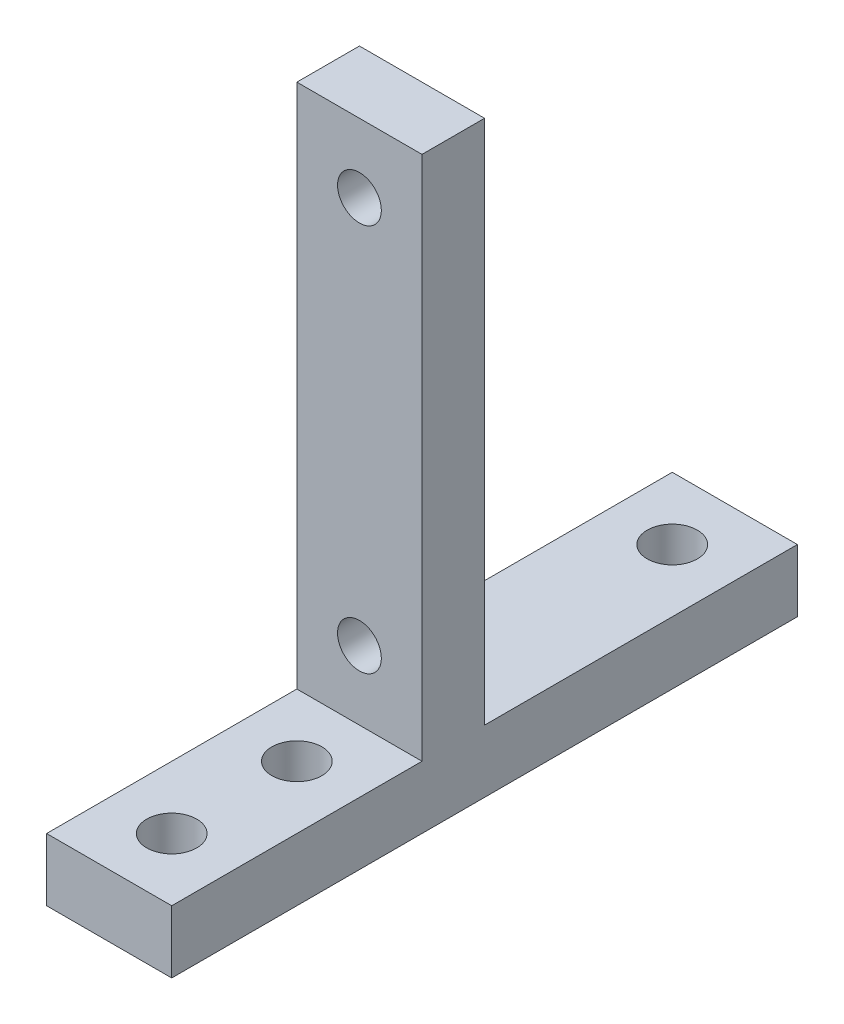
from build123d import *

# Parameters (mm, degrees)
ESBO_O1_W                = 10
ESBO_O1_H                = 42
ESBO_O1_R                = 1.75
RESSALTO_EXTRUS_O1_DEPTH = 5
ESBO_O2_W                = 10
ESBO_O2_H                = 50
ESBO_O2_R                = 2
RESSALTO_EXTRUS_O2_DEPTH = 5


with BuildPart() as part:
    # Esboço1 → Ressalto-extrusão1 (new body)
    with BuildSketch(Plane.XY):
        Rectangle(ESBO_O1_W, ESBO_O1_H)
        with Locations((0, 15.5)):
            Circle(ESBO_O1_R, mode=Mode.SUBTRACT)
        with Locations((0, -15.5)):
            Circle(ESBO_O1_R, mode=Mode.SUBTRACT)
    extrude(amount=RESSALTO_EXTRUS_O1_DEPTH)

    # Esboço2 → Ressalto-extrusão2 (add)
    with BuildSketch(Plane.XZ.offset(21)):
        Rectangle(ESBO_O2_W, ESBO_O2_H)
        with Locations(Location((0, 20, 0), (0, 0, 270))):
            Circle(ESBO_O2_R, mode=Mode.SUBTRACT)
        with Locations(Location((0, -20, 0), (0, 0, 270))):
            Circle(ESBO_O2_R, mode=Mode.SUBTRACT)
        with Locations(Location((0, 10, 0), (0, 0, 270))):
            Circle(ESBO_O2_R, mode=Mode.SUBTRACT)
    extrude(amount=RESSALTO_EXTRUS_O2_DEPTH)


solid = part.part
